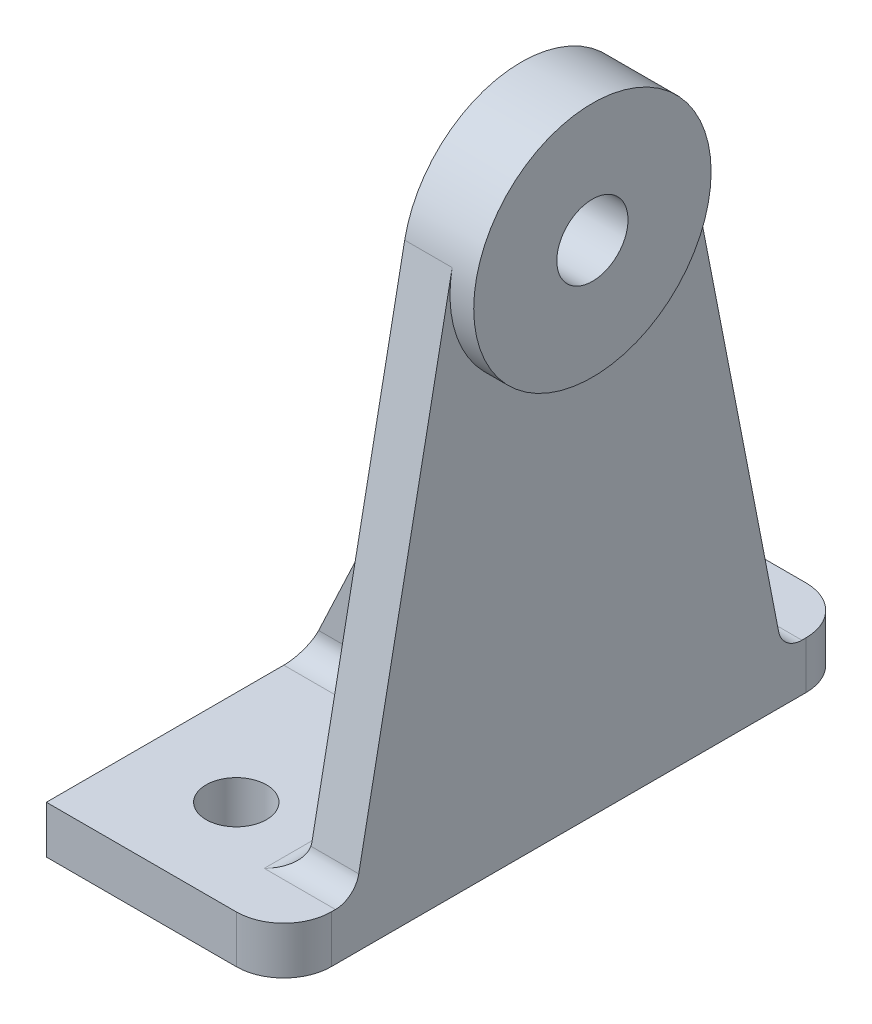
from build123d import *

# Parameters (mm, degrees)
SKETCH2_W       = 31.75
SKETCH2_H       = 76.2
SKETCH2_R       = 4.0386
EXTRUDE1_DEPTH  = 6.35
EXTRUDE2_DEPTH  = 6.35
EXTRUDE3_START  = 3.175
SKETCH4_R       = 15.875
EXTRUDE3_DEPTH  = 3.175
RIB1_REACH      = 117.441
SKETCH6_WALLS_W = 6.35
SKETCH6_WALLS_H = 292.649439439
SKETCH7_R       = 4.7625
EXTRUDE4_DEPTH  = 107.729125594
FILLET1_R       = 3.175
FILLET2_R       = 6.35


with BuildPart() as part:
    # Sketch2 → Extrude1 (new body)
    with BuildSketch(Plane(origin=(0, 0, 0), x_dir=(1, 0, 0), z_dir=(0, 1, 0))):
        with Locations((15.875, 38.1)):
            Rectangle(SKETCH2_W, SKETCH2_H)
        with Locations(Location((12.7, 12.7, 0), (0, 0, 270))):
            Circle(SKETCH2_R, mode=Mode.SUBTRACT)
        with Locations(Location((12.7, 63.5, 0), (0, 0, 90))):
            Circle(SKETCH2_R, mode=Mode.SUBTRACT)
    extrude(amount=-EXTRUDE1_DEPTH)

    # Sketch3 → Extrude2 (add)
    with BuildSketch(Plane(origin=(31.75, 0, 0), x_dir=(0, 0, -1), z_dir=(1, 0, 0))):
        with BuildLine():
            Line((9.525, 0), (66.675, 0))
            Line((66.675, 0), (53.680706216, 66.542567797))
            ThreePointArc((53.680706216, 66.542567797), (38.1, 79.375), (22.519293784, 66.542567797))
            Line((22.519293784, 66.542567797), (9.525, 0))
        make_face()
    extrude(amount=-EXTRUDE2_DEPTH)

    # Sketch4 → Extrude3 (add)
    with BuildSketch(Plane(origin=(31.75, 0, 0), x_dir=(0, 0, -1), z_dir=(1, 0, 0)).offset(EXTRUDE3_START)):
        with Locations((38.1, 63.5)):
            Circle(SKETCH4_R)
    extrude(amount=-EXTRUDE3_DEPTH)

    # Sketch6 walls → Rib1 (add, up to next)
    with BuildSketch(Plane(origin=(0, 0, 0), x_dir=(0, 0, 1), z_dir=(-0.9052035812190267, 0.42497820714508305, 0)), mode=Mode.PRIVATE) as rib1_sk1:
        with Locations((-38.1, 29.883885307)):
            Rectangle(SKETCH6_WALLS_W, SKETCH6_WALLS_H)
    rib1_tool1 = extrude(rib1_sk1.sketch, amount=-RIB1_REACH, mode=Mode.PRIVATE) - part.part
    add(rib1_tool1.solids().sort_by_distance((12.7, 27.051, -38.1))[0])

    # Sketch7 → Extrude4 (cut, through all)
    with BuildSketch(Plane(origin=(25.4, 0, -9.525), x_dir=(0, 0, 1), z_dir=(-1, 0, 0))):
        with Locations((-28.575, 63.5)):
            Circle(SKETCH7_R)
    extrude(amount=-EXTRUDE4_DEPTH, mode=Mode.SUBTRACT)

    # Fillet1
    fillet1_edges = [part.edges().sort_by_distance(p)[0] for p in [
        (28.575, 0, -66.675),
        (28.575, 0, -9.525),
        (25.4, 0, -22.225),
        (25.4, 27.051, -34.925),
        (12.7, 0, -34.925),
        (25.4, 27.051, -41.275),
        (12.7, 0, -41.275),
        (25.4, 0, -53.975),
    ]]
    fillet(fillet1_edges, radius=FILLET1_R)

    # Fillet2
    fillet2_edges = [part.edges().sort_by_distance(p)[0] for p in [
        (31.75, -3.175, -76.2),
        (31.75, -3.175, 0),
    ]]
    fillet(fillet2_edges, radius=FILLET2_R)


solid = part.part
